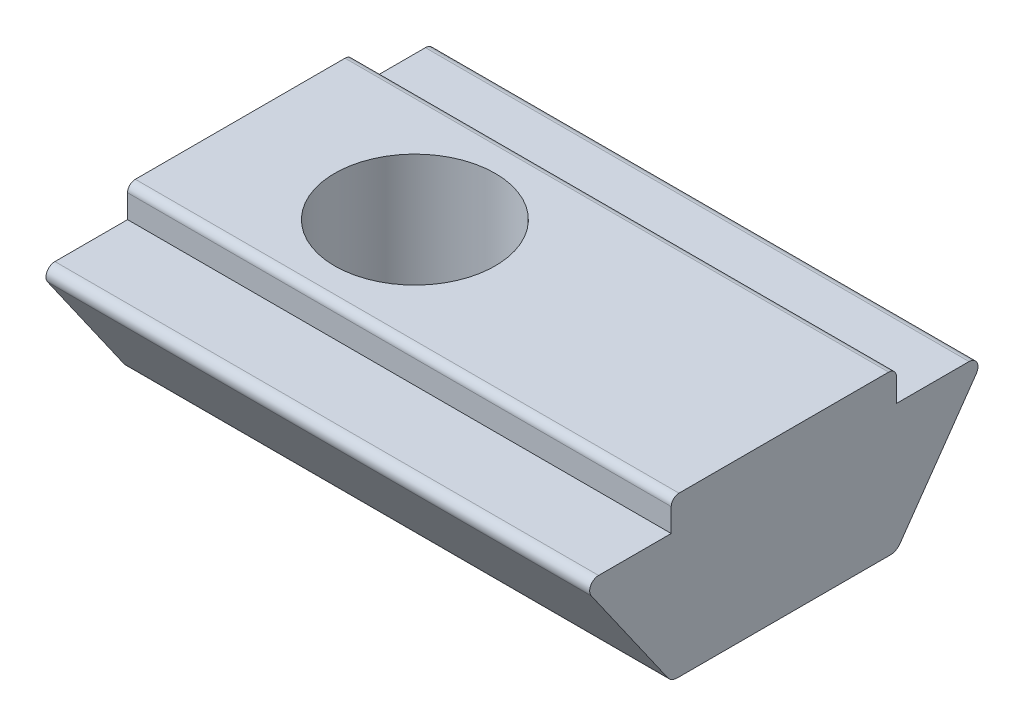
from build123d import *

# Parameters (mm, degrees)
BOSS_EXTRUDE1_DEPTH = 14
FILLET1_R           = 0.3
FILLET2_R           = 0.2
SKETCH2_W           = 2.1
SKETCH2_H           = 0.2
TAPPED_HOLE1_D      = 4.134


with BuildPart() as part:
    # Sketch1 → Boss-Extrude1 (new body)
    with BuildSketch(Plane(origin=(-4.5, 0, 0), x_dir=(0, 0, -1), z_dir=(1, 0, 0))):
        with BuildLine():
            Line((2.9, 0), (-2.9, 0))
            Line((-2.9, 0), (-2.9, -0.8))
            Line((-2.9, -0.8), (-4.77, -0.8))
            ThreePointArc((-4.77, -0.8), (-4.974026325, -0.923824397), (-4.958370592, -1.161971664))
            Line((-4.958370592, -1.161971664), (-2.9, -4.1))
            Line((-2.9, -4.1), (2.9, -4.1))
            Line((2.9, -4.1), (4.958370592, -1.161971664))
            ThreePointArc((4.958370592, -1.161971664), (4.974026325, -0.923824397), (4.77, -0.8))
            Line((4.77, -0.8), (2.9, -0.8))
            Line((2.9, -0.8), (2.9, 0))
        make_face()
    extrude(amount=BOSS_EXTRUDE1_DEPTH)

    # Fillet1
    fillet1_edges = [part.edges().sort_by_distance(p)[0] for p in [
        (2.5, -4.1, -2.9),
        (2.5, -4.1, 2.9),
    ]]
    fillet(fillet1_edges, radius=FILLET1_R)

    # Fillet2
    fillet2_edges = [part.edges().sort_by_distance(p)[0] for p in [
        (2.5, 0, 2.9),
        (2.5, 0, -2.9),
    ]]
    fillet(fillet2_edges, radius=FILLET2_R)

    # Sketch2 → Cut-Revolve1 (revolve, cut)
    with BuildSketch(Plane(origin=(6, 0, 0), x_dir=(0, 0, -1), z_dir=(1, 0, 0)), mode=Mode.PRIVATE) as cut_revolve1_sk:
        with Locations((1.05, -4)):
            Rectangle(SKETCH2_W, SKETCH2_H)
    revolve(cut_revolve1_sk.sketch.rotate(Axis((6, 1.665548573, 0), (0, -1, 0)), 180), axis=Axis((6, 1.665548573, 0), (0, -1, 0)), mode=Mode.SUBTRACT)

    # Sketch3 → Revolve1 (revolve)
    with BuildSketch(Plane(origin=(6, 0, 0), x_dir=(0, 0, -1), z_dir=(1, 0, 0)), mode=Mode.PRIVATE) as revolve1_sk:
        with BuildLine():
            Line((1.670329309, -3.9), (0, -3.9))
            Line((0, -3.9), (0, -4.8))
            ThreePointArc((0, -4.8), (0.948683298, -4.560681686), (1.670329309, -3.9))
        make_face()
    revolve(revolve1_sk.sketch.rotate(Axis((6, 0, 0), (0, -1, 0)), 180), axis=Axis((6, 0, 0), (0, -1, 0)))

    # Tapped Hole1 (through all)
    with Locations(Plane(origin=(0, 0, 0), x_dir=(1, 0, 0), z_dir=(0, 1, 0))):
        with Locations((0, 0)):
            Hole(TAPPED_HOLE1_D / 2)


solid = part.part
